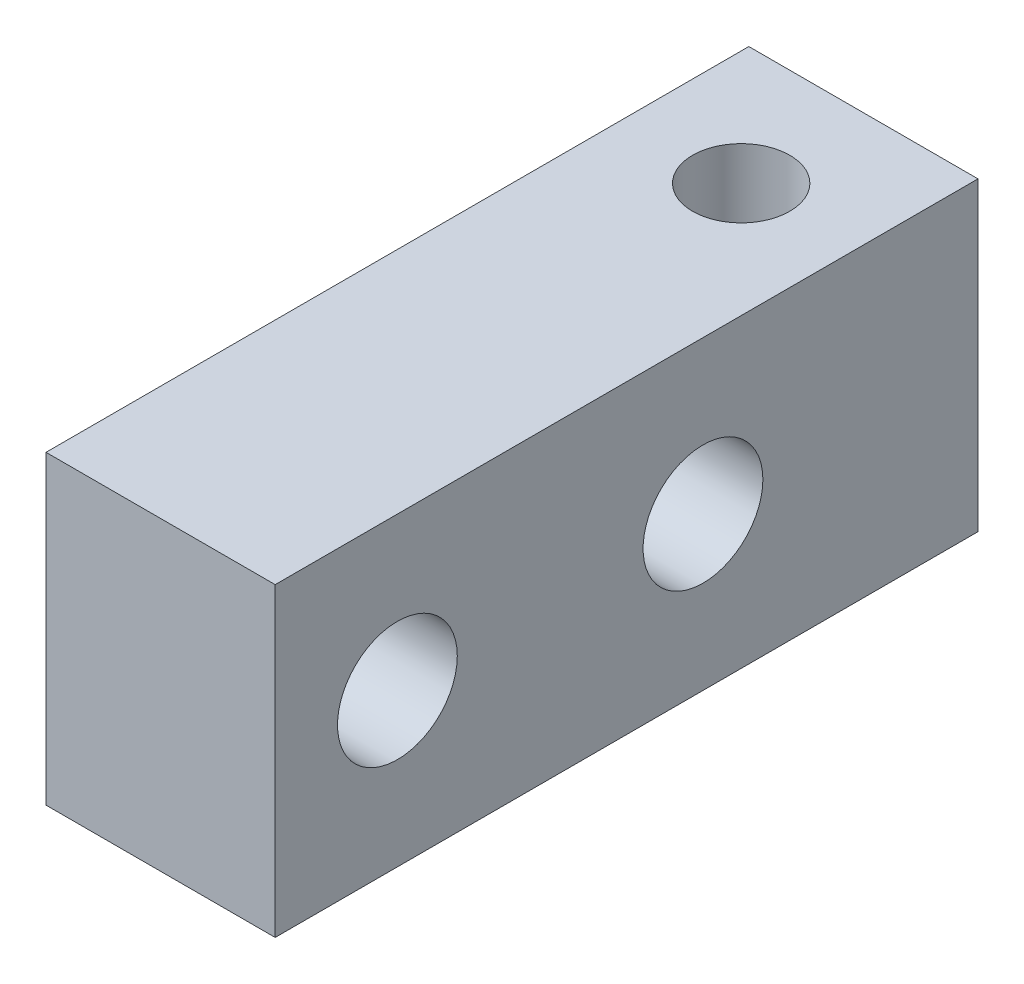
from build123d import *

# Parameters (mm, degrees)
SKETCH1_W              = 29.21
SKETCH1_H              = 12.7
BOSS_EXTRUDE1_DEPTH    = 4.7625
F_10_32_TAPPED_HOLE1_D = 4.0386
F_10_CLEARANCE_HOLE1_D = 4.9784


with BuildPart() as part:
    # Sketch1 → Boss-Extrude1 (new, symmetric)
    with BuildSketch(Plane(origin=(0, 0, 0), x_dir=(0, 0, -1), z_dir=(1, 0, 0))):
        with Locations((-9.525, 0)):
            Rectangle(SKETCH1_W, SKETCH1_H)
    extrude(amount=BOSS_EXTRUDE1_DEPTH, both=True)

    # #10-32 Tapped Hole1 (through all)
    with Locations(Plane(origin=(0, 6.35, 0), x_dir=(1, 0, 0), z_dir=(0, 1, 0))):
        with Locations((0, 0)):
            Hole(F_10_32_TAPPED_HOLE1_D / 2)

    # #10 Clearance Hole1 (through all)
    with Locations(Plane(origin=(4.7625, 0, 0), x_dir=(0, 0, -1), z_dir=(1, 0, 0))):
        with Locations((-6.35, 0), (-19.05, 0)):
            Hole(F_10_CLEARANCE_HOLE1_D / 2)


solid = part.part
